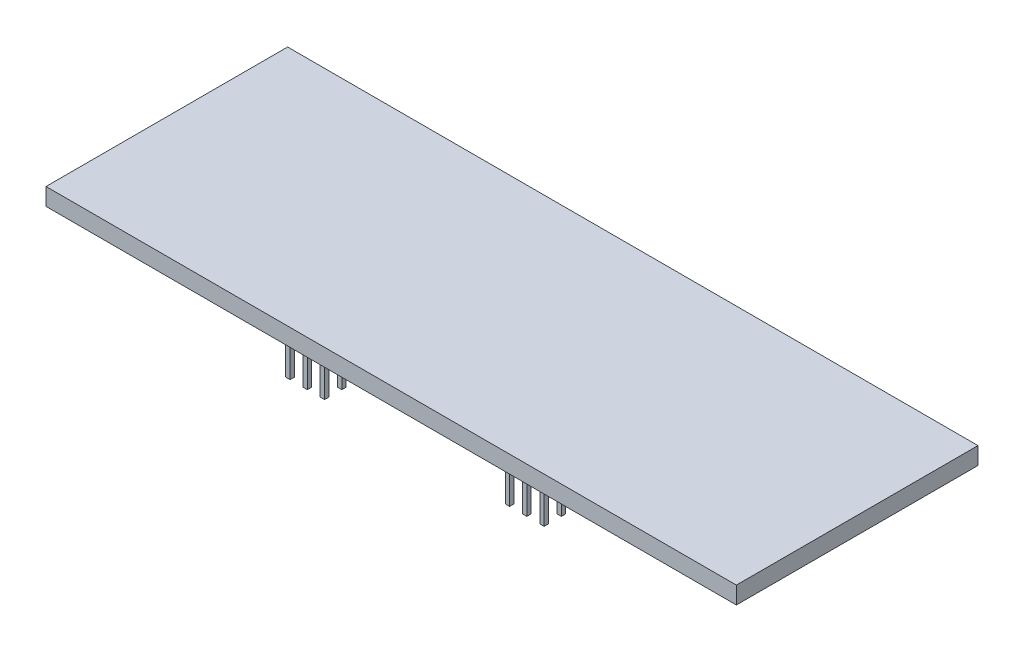
from build123d import *

# Parameters (mm, degrees)
SKETCH1_W           = 101.6
SKETCH1_H           = 35.56
BOSS_EXTRUDE1_DEPTH = 2.54
SKETCH2_W           = 7.62
SKETCH2_H           = 30.48
BOSS_EXTRUDE2_DEPTH = 2.54
SKETCH3_W           = 0.635
SKETCH3_H           = 0.635
BOSS_EXTRUDE3_DEPTH = 5.08


with BuildPart() as part:
    # Sketch1 → Boss-Extrude1 (new body)
    with BuildSketch(Plane(origin=(0, 0, 0), x_dir=(1, 0, 0), z_dir=(0, 1, 0))):
        with Locations((50.8, 17.78)):
            Rectangle(SKETCH1_W, SKETCH1_H)
    extrude(amount=BOSS_EXTRUDE1_DEPTH)

    # Sketch2 → Boss-Extrude2 (add)
    with BuildSketch(Plane.XZ):
        with Locations((34.6456, -17.78)):
            Rectangle(SKETCH2_W, SKETCH2_H)
        with Locations((66.9544, -17.78)):
            Rectangle(SKETCH2_W, SKETCH2_H)
    extrude(amount=BOSS_EXTRUDE2_DEPTH)

    # Sketch3 → Boss-Extrude3 (add)
    with BuildSketch(Plane.XZ.offset(2.54)):
        with Locations((32.1056, -3.81)):
            Rectangle(SKETCH3_W, SKETCH3_H)
        with Locations((34.6456, -3.81)):
            Rectangle(SKETCH3_W, SKETCH3_H)
        with Locations((37.1856, -3.81)):
            Rectangle(SKETCH3_W, SKETCH3_H)
        with Locations((32.1056, -6.35)):
            Rectangle(SKETCH3_W, SKETCH3_H)
        with Locations((34.6456, -6.35)):
            Rectangle(SKETCH3_W, SKETCH3_H)
        with Locations((37.1856, -6.35)):
            Rectangle(SKETCH3_W, SKETCH3_H)
        with Locations((32.1056, -8.89)):
            Rectangle(SKETCH3_W, SKETCH3_H)
        with Locations((34.6456, -8.89)):
            Rectangle(SKETCH3_W, SKETCH3_H)
        with Locations((37.1856, -8.89)):
            Rectangle(SKETCH3_W, SKETCH3_H)
        with Locations((32.1056, -11.43)):
            Rectangle(SKETCH3_W, SKETCH3_H)
        with Locations((34.6456, -11.43)):
            Rectangle(SKETCH3_W, SKETCH3_H)
        with Locations((37.1856, -11.43)):
            Rectangle(SKETCH3_W, SKETCH3_H)
        with Locations((32.1056, -13.97)):
            Rectangle(SKETCH3_W, SKETCH3_H)
        with Locations((34.6456, -13.97)):
            Rectangle(SKETCH3_W, SKETCH3_H)
        with Locations((37.1856, -13.97)):
            Rectangle(SKETCH3_W, SKETCH3_H)
        with Locations((32.1056, -16.51)):
            Rectangle(SKETCH3_W, SKETCH3_H)
        with Locations((34.6456, -16.51)):
            Rectangle(SKETCH3_W, SKETCH3_H)
        with Locations((37.1856, -16.51)):
            Rectangle(SKETCH3_W, SKETCH3_H)
        with Locations((32.1056, -19.05)):
            Rectangle(SKETCH3_W, SKETCH3_H)
        with Locations((34.6456, -19.05)):
            Rectangle(SKETCH3_W, SKETCH3_H)
        with Locations((37.1856, -19.05)):
            Rectangle(SKETCH3_W, SKETCH3_H)
        with Locations((32.1056, -21.59)):
            Rectangle(SKETCH3_W, SKETCH3_H)
        with Locations((34.6456, -21.59)):
            Rectangle(SKETCH3_W, SKETCH3_H)
        with Locations((37.1856, -21.59)):
            Rectangle(SKETCH3_W, SKETCH3_H)
        with Locations((32.1056, -24.13)):
            Rectangle(SKETCH3_W, SKETCH3_H)
        with Locations((34.6456, -24.13)):
            Rectangle(SKETCH3_W, SKETCH3_H)
        with Locations((37.1856, -24.13)):
            Rectangle(SKETCH3_W, SKETCH3_H)
        with Locations((32.1056, -26.67)):
            Rectangle(SKETCH3_W, SKETCH3_H)
        with Locations((34.6456, -26.67)):
            Rectangle(SKETCH3_W, SKETCH3_H)
        with Locations((37.1856, -26.67)):
            Rectangle(SKETCH3_W, SKETCH3_H)
        with Locations((32.1056, -29.21)):
            Rectangle(SKETCH3_W, SKETCH3_H)
        with Locations((34.6456, -29.21)):
            Rectangle(SKETCH3_W, SKETCH3_H)
        with Locations((37.1856, -29.21)):
            Rectangle(SKETCH3_W, SKETCH3_H)
        with Locations((32.1056, -31.75)):
            Rectangle(SKETCH3_W, SKETCH3_H)
        with Locations((34.6456, -31.75)):
            Rectangle(SKETCH3_W, SKETCH3_H)
        with Locations((37.1856, -31.75)):
            Rectangle(SKETCH3_W, SKETCH3_H)
        with Locations((64.4144, -31.75)):
            Rectangle(SKETCH3_W, SKETCH3_H)
        with Locations((66.9544, -31.75)):
            Rectangle(SKETCH3_W, SKETCH3_H)
        with Locations((69.4944, -31.75)):
            Rectangle(SKETCH3_W, SKETCH3_H)
        with Locations((64.4144, -29.21)):
            Rectangle(SKETCH3_W, SKETCH3_H)
        with Locations((66.9544, -29.21)):
            Rectangle(SKETCH3_W, SKETCH3_H)
        with Locations((69.4944, -29.21)):
            Rectangle(SKETCH3_W, SKETCH3_H)
        with Locations((64.4144, -26.67)):
            Rectangle(SKETCH3_W, SKETCH3_H)
        with Locations((66.9544, -26.67)):
            Rectangle(SKETCH3_W, SKETCH3_H)
        with Locations((69.4944, -26.67)):
            Rectangle(SKETCH3_W, SKETCH3_H)
        with Locations((64.4144, -24.13)):
            Rectangle(SKETCH3_W, SKETCH3_H)
        with Locations((66.9544, -24.13)):
            Rectangle(SKETCH3_W, SKETCH3_H)
        with Locations((69.4944, -24.13)):
            Rectangle(SKETCH3_W, SKETCH3_H)
        with Locations((64.4144, -21.59)):
            Rectangle(SKETCH3_W, SKETCH3_H)
        with Locations((66.9544, -21.59)):
            Rectangle(SKETCH3_W, SKETCH3_H)
        with Locations((69.4944, -21.59)):
            Rectangle(SKETCH3_W, SKETCH3_H)
        with Locations((64.4144, -19.05)):
            Rectangle(SKETCH3_W, SKETCH3_H)
        with Locations((66.9544, -19.05)):
            Rectangle(SKETCH3_W, SKETCH3_H)
        with Locations((69.4944, -19.05)):
            Rectangle(SKETCH3_W, SKETCH3_H)
        with Locations((64.4144, -16.51)):
            Rectangle(SKETCH3_W, SKETCH3_H)
        with Locations((66.9544, -16.51)):
            Rectangle(SKETCH3_W, SKETCH3_H)
        with Locations((69.4944, -16.51)):
            Rectangle(SKETCH3_W, SKETCH3_H)
        with Locations((64.4144, -13.97)):
            Rectangle(SKETCH3_W, SKETCH3_H)
        with Locations((66.9544, -13.97)):
            Rectangle(SKETCH3_W, SKETCH3_H)
        with Locations((69.4944, -13.97)):
            Rectangle(SKETCH3_W, SKETCH3_H)
        with Locations((64.4144, -11.43)):
            Rectangle(SKETCH3_W, SKETCH3_H)
        with Locations((66.9544, -11.43)):
            Rectangle(SKETCH3_W, SKETCH3_H)
        with Locations((69.4944, -11.43)):
            Rectangle(SKETCH3_W, SKETCH3_H)
        with Locations((64.4144, -8.89)):
            Rectangle(SKETCH3_W, SKETCH3_H)
        with Locations((66.9544, -8.89)):
            Rectangle(SKETCH3_W, SKETCH3_H)
        with Locations((69.4944, -8.89)):
            Rectangle(SKETCH3_W, SKETCH3_H)
        with Locations((64.4144, -6.35)):
            Rectangle(SKETCH3_W, SKETCH3_H)
        with Locations((66.9544, -6.35)):
            Rectangle(SKETCH3_W, SKETCH3_H)
        with Locations((69.4944, -6.35)):
            Rectangle(SKETCH3_W, SKETCH3_H)
        with Locations((64.4144, -3.81)):
            Rectangle(SKETCH3_W, SKETCH3_H)
        with Locations((66.9544, -3.81)):
            Rectangle(SKETCH3_W, SKETCH3_H)
        with Locations((69.4944, -3.81)):
            Rectangle(SKETCH3_W, SKETCH3_H)
    extrude(amount=BOSS_EXTRUDE3_DEPTH)


solid = part.part
